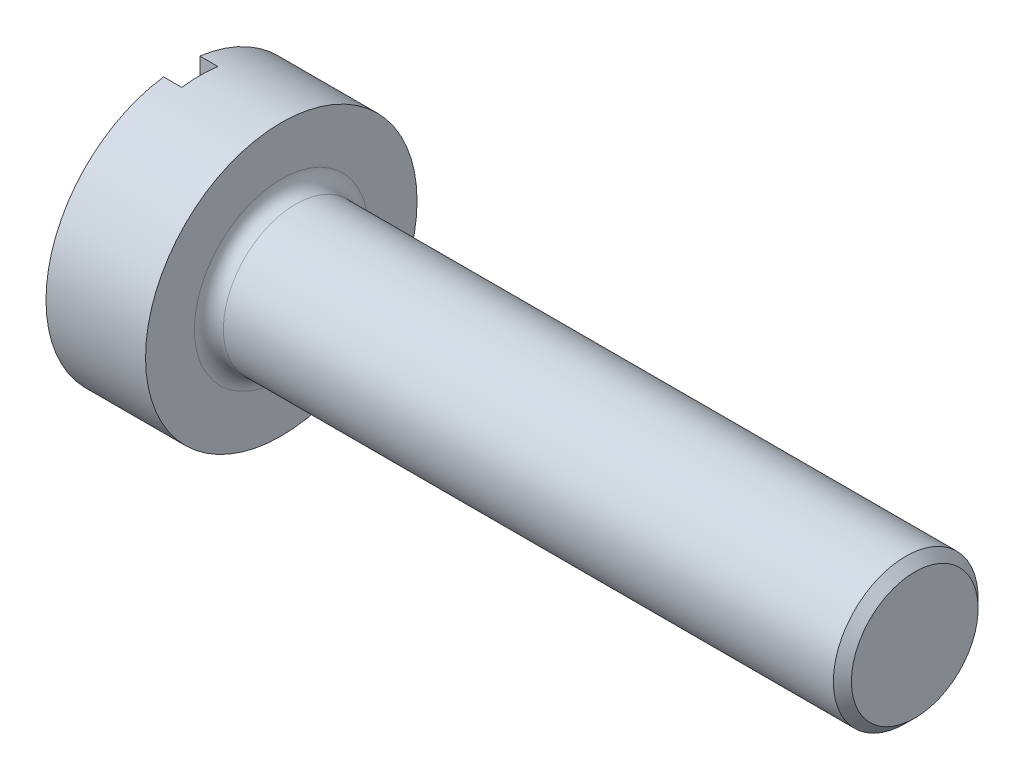
from build123d import *

# Parameters (mm, degrees)
SKETCH1_W           = 7
SKETCH1_H           = 0.8
CHAMFER1_SIZE       = 0.1
FILLET1_R           = 0.16
EXTRUDE1_DEPTH      = 9.373171442
EXTRUDE1_DEPTH_BACK = 9.373171442
SKETCH2_W           = 0.2
SKETCH2_H           = 0.2


with BuildPart() as part:
    # Sketch1 → Revolve1 (revolve)
    with BuildSketch(Plane.XY, mode=Mode.PRIVATE) as revolve1_sk:
        Polygon((0, 1.5), (0, 0), (1.1, 0), (1.1, 0.8), (1.1, 1.5), align=None)
        with Locations((4.6, 0.4)):
            Rectangle(SKETCH1_W, SKETCH1_H)
    revolve(revolve1_sk.sketch.rotate(Axis((0, 0, 0), (1, 0, 0)), 90), axis=Axis((0, 0, 0), (1, 0, 0)))

    # Chamfer1
    chamfer1_edges = [part.edges().sort_by_distance(p)[0] for p in [
        (8.1, 0, -0.8),
    ]]
    chamfer(chamfer1_edges, length=CHAMFER1_SIZE)

    # Fillet1
    fillet1_edges = [part.edges().sort_by_distance(p)[0] for p in [
        (1.1, 0, -0.8),
    ]]
    fillet(fillet1_edges, radius=FILLET1_R)

    # Sketch2 → Extrude1 (cut, two sides: drawn at the far end of the back side and taken through both)
    with BuildSketch(Plane(origin=(0, 0, 0), x_dir=(1, 0, 0), z_dir=(0, 1, 0)).offset(-EXTRUDE1_DEPTH_BACK)):
        with Locations((0.1, -0.1)):
            Rectangle(SKETCH2_W, SKETCH2_H)
        with Locations((0.1, 0.1)):
            Rectangle(SKETCH2_W, SKETCH2_H)
    extrude(amount=EXTRUDE1_DEPTH + EXTRUDE1_DEPTH_BACK, mode=Mode.SUBTRACT)


solid = part.part
